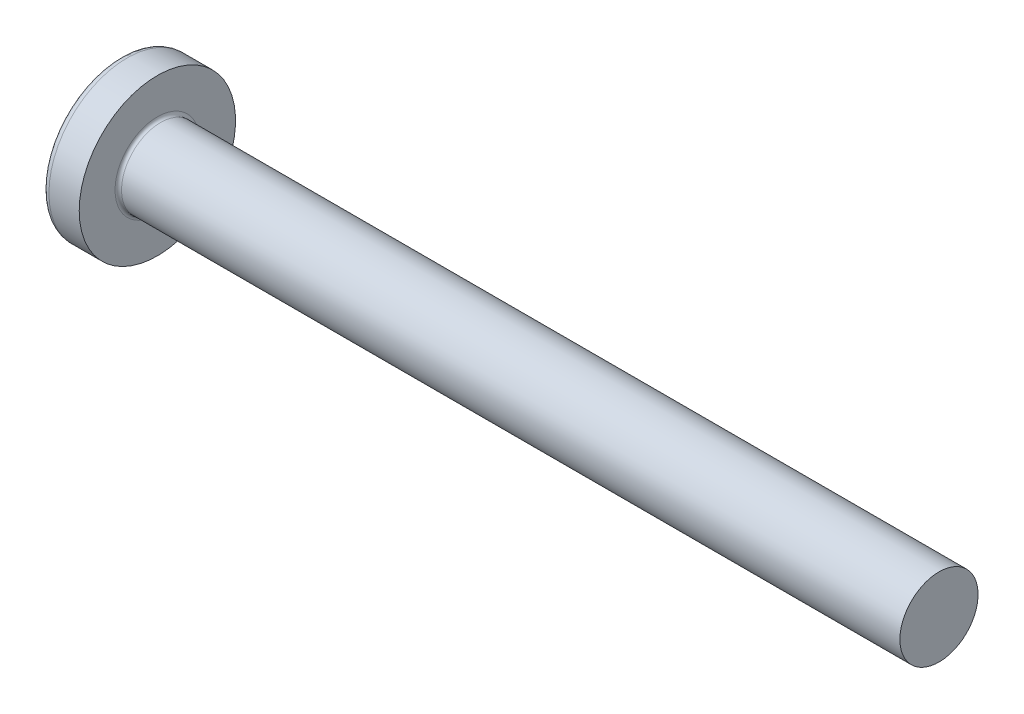
from build123d import *

# Parameters (mm, degrees)
FILLET1_R    = 0.25
RECPAT_COUNT = 2
RECPAT_ANGLE = 90


with BuildPart() as part:
    # BodySke → Base-Revolve (revolve)
    with BuildSketch(Plane.XY, mode=Mode.PRIVATE) as base_revolve_sk:
        with BuildLine():
            Line((4.6, 3), (4.6, 6))
            Line((4.6, 6), (2.274716834, 6))
            ThreePointArc((2.274716834, 6), (2.026424569, 5.939532013), (1.833738725, 5.77167019))
            ThreePointArc((1.833738725, 5.77167019), (0.469454036, 3.027985077), (0, 0))
            Line((0, 0), (64.6, 0))
            Line((64.6, 0), (64.6, 3))
            Line((64.6, 3), (4.6, 3))
        make_face()
    revolve(base_revolve_sk.sketch.rotate(Axis((2.274716834, 0, 0), (1, 0, 0)), 90), axis=Axis((2.274716834, 0, 0), (1, 0, 0)))

    # Fillet1
    fillet1_edges = [part.edges().sort_by_distance(p)[0] for p in [
        (4.6, 0, -3),
    ]]
    fillet(fillet1_edges, radius=FILLET1_R)

    # Sketch3 → Recess section 0
    with BuildSketch(Plane(origin=(0, 0, 0), x_dir=(0, 0, -1), z_dir=(1, 0, 0))):
        with BuildLine():
            Line((0.71, -3.35), (-0.71, -3.35))
            Line((-0.71, -3.35), (-0.71, 3.35))
            Line((-0.71, 3.35), (0.71, 3.35))
            Line((0.71, 3.35), (0.71, -3.35))
        make_face()
    # Sketch4 → Recess section 1
    with BuildSketch(Plane(origin=(3.46, 0, 0), x_dir=(0, 0, -1), z_dir=(1, 0, 0))):
        with BuildLine():
            Line((0.71, -1.624907925), (-0.71, -1.624907925))
            Line((-0.71, -1.624907925), (-0.71, 1.624907925))
            Line((-0.71, 1.624907925), (0.71, 1.624907925))
            Line((0.71, 1.624907925), (0.71, -1.624907925))
        make_face()
    recess = loft(mode=Mode.SUBTRACT)

    # RecPat: Recess ×2 about axis
    recpat_axis = Axis((0, 0, 0), (1, 0, 0))
    for i in range(1, RECPAT_COUNT):
        add(recess.rotate(recpat_axis, i * RECPAT_ANGLE / (RECPAT_COUNT - 1)), mode=Mode.SUBTRACT)

    # RecCorSke → RecessCore (revolve, cut)
    with BuildSketch(Plane.XY, mode=Mode.PRIVATE) as recesscore_sk:
        Polygon((0, 0), (0, 1.522446769), (3.46, 1.2805), (3.876059671, 0), align=None)
    revolve(recesscore_sk.sketch.rotate(Axis((-3.175, 0, 0), (1, 0, 0)), 12.930791927), axis=Axis((-3.175, 0, 0), (1, 0, 0)), mode=Mode.SUBTRACT)


solid = part.part
